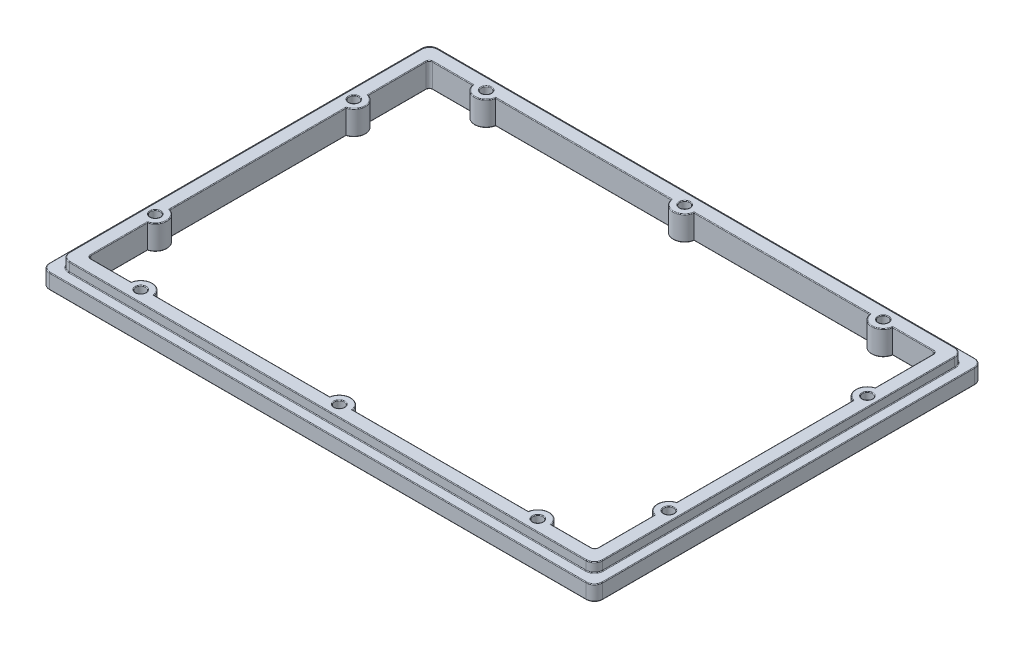
from build123d import *

# Parameters (mm, degrees)
EXTRUDE1_DEPTH = 5.842
EXTRUDE2_DEPTH = 3.556
EXTRUDE3_DEPTH = 131.070632308
SKETCH4_R      = 1.905
EXTRUDE4_DEPTH = 131.070632308
FILLET1_R      = 0.254


with BuildPart() as part:
    # Sketch1 → Extrude1 (new body)
    with BuildSketch(Plane(origin=(0, 0, 0), x_dir=(1, 0, 0), z_dir=(0, 1, 0))):
        with BuildLine():
            Line((-102.997, 74.549), (102.997, 74.549))
            ThreePointArc((102.997, 74.549), (105.24206403, 73.61906403), (106.172, 71.374))
            Line((106.172, 71.374), (106.172, -71.374))
            ThreePointArc((106.172, -71.374), (105.24206403, -73.61906403), (102.997, -74.549))
            Line((102.997, -74.549), (-102.997, -74.549))
            ThreePointArc((-102.997, -74.549), (-105.24206403, -73.61906403), (-106.172, -71.374))
            Line((-106.172, -71.374), (-106.172, 71.374))
            ThreePointArc((-106.172, 71.374), (-105.24206403, 73.61906403), (-102.997, 74.549))
        make_face()
    extrude(amount=EXTRUDE1_DEPTH)

    # Sketch2 → Extrude2 (add)
    with BuildSketch(Plane(origin=(0, 5.842, 0), x_dir=(1, 0, 0), z_dir=(0, 1, 0))):
        with BuildLine():
            Line((-99.187, 70.739), (99.187, 70.739))
            ThreePointArc((99.187, 70.739), (101.43206403, 69.80906403), (102.362, 67.564))
            Line((102.362, 67.564), (102.362, -67.564))
            ThreePointArc((102.362, -67.564), (101.43206403, -69.80906403), (99.187, -70.739))
            Line((99.187, -70.739), (-99.187, -70.739))
            ThreePointArc((-99.187, -70.739), (-101.43206403, -69.80906403), (-102.362, -67.564))
            Line((-102.362, -67.564), (-102.362, 67.564))
            ThreePointArc((-102.362, 67.564), (-101.43206403, 69.80906403), (-99.187, 70.739))
        make_face()
    extrude(amount=EXTRUDE2_DEPTH)

    # Sketch3 → Extrude3 (cut, through all)
    with BuildSketch(Plane(origin=(0, 9.398, 0), x_dir=(1, 0, 0), z_dir=(0, 1, 0))):
        with BuildLine():
            Line((80.579198671, 65.532), (96.012, 65.532))
            ThreePointArc((96.012, 65.532), (96.910025612, 65.160025612), (97.282, 64.262))
            Line((97.282, 64.262), (97.282, 42.105709497))
            ThreePointArc((97.282, 42.105709497), (94.107, 37.846), (97.282, 33.586290503))
            Line((97.282, 33.586290503), (97.282, -34.094290503))
            ThreePointArc((97.282, -34.094290503), (94.107, -38.354), (97.282, -42.613709497))
            Line((97.282, -42.613709497), (97.282, -64.262))
            ThreePointArc((97.282, -64.262), (96.910025612, -65.160025612), (96.012, -65.532))
            Line((96.012, -65.532), (80.579198671, -65.532))
            ThreePointArc((80.579198671, -65.532), (76.2, -61.849), (71.820801329, -65.532))
            Line((71.820801329, -65.532), (4.379198671, -65.532))
            ThreePointArc((4.379198671, -65.532), (0, -61.849), (-4.379198671, -65.532))
            Line((-4.379198671, -65.532), (-71.820801329, -65.532))
            ThreePointArc((-71.820801329, -65.532), (-76.2, -61.849), (-80.579198671, -65.532))
            Line((-80.579198671, -65.532), (-96.012, -65.532))
            ThreePointArc((-96.012, -65.532), (-96.910025612, -65.160025612), (-97.282, -64.262))
            Line((-97.282, -64.262), (-97.282, -42.613709497))
            ThreePointArc((-97.282, -42.613709497), (-94.107, -38.354), (-97.282, -34.094290503))
            Line((-97.282, -34.094290503), (-97.282, 33.586290503))
            ThreePointArc((-97.282, 33.586290503), (-94.107, 37.846), (-97.282, 42.105709497))
            Line((-97.282, 42.105709497), (-97.282, 64.262))
            ThreePointArc((-97.282, 64.262), (-96.910025612, 65.160025612), (-96.012, 65.532))
            Line((-96.012, 65.532), (-80.579198671, 65.532))
            ThreePointArc((-80.579198671, 65.532), (-76.2, 61.849), (-71.820801329, 65.532))
            Line((-71.820801329, 65.532), (-4.379198671, 65.532))
            ThreePointArc((-4.379198671, 65.532), (0, 61.849), (4.379198671, 65.532))
            Line((4.379198671, 65.532), (71.820801329, 65.532))
            ThreePointArc((71.820801329, 65.532), (76.2, 61.849), (80.579198671, 65.532))
        make_face()
    extrude(amount=-EXTRUDE3_DEPTH, mode=Mode.SUBTRACT)

    # Sketch4 → Extrude4 (cut, through all)
    with BuildSketch(Plane(origin=(0, 9.398, 0), x_dir=(1, 0, 0), z_dir=(0, 1, 0))):
        with Locations(Location((-98.552, 37.846, 0), (0, 0, 270))):
            Circle(SKETCH4_R)
        with Locations(Location((-76.2, 66.294, 0), (0, 0, 270))):
            Circle(SKETCH4_R)
        with Locations(Location((0, 66.294, 0), (0, 0, 270))):
            Circle(SKETCH4_R)
        with Locations(Location((76.2, 66.294, 0), (0, 0, 270))):
            Circle(SKETCH4_R)
        with Locations(Location((98.552, 37.846, 0), (0, 0, 270))):
            Circle(SKETCH4_R)
        with Locations(Location((98.552, -38.354, 0), (0, 0, 270))):
            Circle(SKETCH4_R)
        with Locations(Location((76.2, -66.294, 0), (0, 0, 270))):
            Circle(SKETCH4_R)
        with Locations(Location((0, -66.294, 0), (0, 0, 270))):
            Circle(SKETCH4_R)
        with Locations(Location((-76.2, -66.294, 0), (0, 0, 270))):
            Circle(SKETCH4_R)
        with Locations(Location((-98.552, -38.354, 0), (0, 0, 270))):
            Circle(SKETCH4_R)
    extrude(amount=-EXTRUDE4_DEPTH, mode=Mode.SUBTRACT)

    # Fillet1
    fillet1_edges = [part.edges().sort_by_distance(p)[0] for p in [
        (-105.24206403, 5.842, 73.61906403),
        (-106.172, 0, 0),
        (-105.24206403, 0, -73.61906403),
        (0, 5.842, 74.549),
        (-98.552, 0, -39.751),
        (-98.552, 9.398, -39.751),
        (-76.2, 0, -68.199),
        (-76.2, 9.398, -68.199),
        (0, 0, -68.199),
        (0, 9.398, -68.199),
        (76.2, 0, -68.199),
        (76.2, 9.398, -68.199),
        (98.552, 0, -39.751),
        (98.552, 9.398, -39.751),
        (98.552, 0, 36.449),
        (98.552, 9.398, 36.449),
        (76.2, 0, 64.389),
        (105.24206403, 5.842, 73.61906403),
        (76.2, 9.398, 64.389),
        (0, 0, 64.389),
        (0, 9.398, 64.389),
        (-76.2, 0, 64.389),
        (-76.2, 9.398, 64.389),
        (-98.552, 0, 36.449),
        (-98.552, 9.398, 36.449),
        (106.172, 5.842, 0),
        (105.24206403, 5.842, -73.61906403),
        (0, 5.842, -74.549),
        (-101.43206403, 5.842, -69.80906403),
        (-102.362, 5.842, 0),
        (-101.43206403, 5.842, 69.80906403),
        (0, 5.842, 70.739),
        (101.43206403, 5.842, 69.80906403),
        (102.362, 5.842, 0),
        (101.43206403, 5.842, -69.80906403),
        (0, 5.842, -70.739),
        (0, 9.398, -70.739),
        (-101.43206403, 9.398, -69.80906403),
        (-102.362, 9.398, 0),
        (-101.43206403, 9.398, 69.80906403),
        (0, 9.398, 70.739),
        (101.43206403, 9.398, 69.80906403),
        (102.362, 9.398, 0),
        (101.43206403, 9.398, -69.80906403),
        (-105.24206403, 5.842, -73.61906403),
        (-96.910025612, 0, -65.160025612),
        (-88.295599335, 0, -65.532),
        (-76.2, 0, -61.849),
        (-106.172, 5.842, 0),
        (-38.1, 0, -65.532),
        (0, 0, -61.849),
        (38.1, 0, -65.532),
        (76.2, 0, -61.849),
        (88.295599335, 0, -65.532),
        (96.910025612, 0, -65.160025612),
        (97.282, 0, -53.183854749),
        (94.107, 0, -37.846),
        (97.282, 0, 0.254),
        (94.107, 0, 38.354),
        (97.282, 0, 53.437854749),
        (96.910025612, 0, 65.160025612),
        (88.295599335, 0, 65.532),
        (76.2, 0, 61.849),
        (38.1, 0, 65.532),
        (0, 0, 61.849),
        (-38.1, 0, 65.532),
        (-76.2, 0, 61.849),
        (0, 0, -74.549),
        (-88.295599335, 0, 65.532),
        (-96.910025612, 0, 65.160025612),
        (-97.282, 0, 53.437854749),
        (-94.107, 0, 38.354),
        (-97.282, 0, 0.254),
        (-94.107, 0, -37.846),
        (-97.282, 0, -53.183854749),
        (-96.910025612, 9.398, -65.160025612),
        (-97.282, 9.398, -53.183854749),
        (-94.107, 9.398, -37.846),
        (-97.282, 9.398, 0.254),
        (105.24206403, 0, -73.61906403),
        (-94.107, 9.398, 38.354),
        (-97.282, 9.398, 53.437854749),
        (-96.910025612, 9.398, 65.160025612),
        (-88.295599335, 9.398, 65.532),
        (-76.2, 9.398, 61.849),
        (-38.1, 9.398, 65.532),
        (0, 9.398, 61.849),
        (38.1, 9.398, 65.532),
        (76.2, 9.398, 61.849),
        (88.295599335, 9.398, 65.532),
        (96.910025612, 9.398, 65.160025612),
        (97.282, 9.398, 53.437854749),
        (94.107, 9.398, 38.354),
        (106.172, 0, 0),
        (97.282, 9.398, 0.254),
        (94.107, 9.398, -37.846),
        (97.282, 9.398, -53.183854749),
        (96.910025612, 9.398, -65.160025612),
        (88.295599335, 9.398, -65.532),
        (76.2, 9.398, -61.849),
        (38.1, 9.398, -65.532),
        (0, 9.398, -61.849),
        (-38.1, 9.398, -65.532),
        (-76.2, 9.398, -61.849),
        (-88.295599335, 9.398, -65.532),
        (105.24206403, 0, 73.61906403),
        (0, 0, 74.549),
        (-105.24206403, 0, 73.61906403),
    ]]
    fillet(fillet1_edges, radius=FILLET1_R)


solid = part.part
